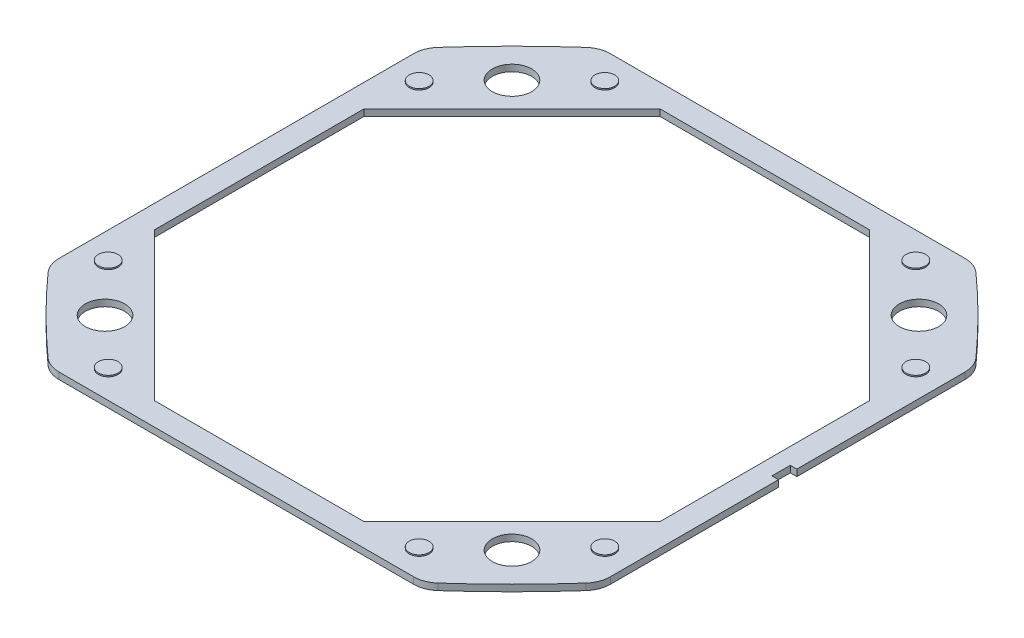
from build123d import *

# Parameters (mm, degrees)
ESBO_O1_R                = 1.5
RESSALTO_EXTRUS_O1_DEPTH = 0.25
RESSALTO_EXTRUS_O2_START = 0.25
ESBO_O1_3_R              = 0.75
RESSALTO_EXTRUS_O2_DEPTH = 0.1
CORTE_EXTRUS_O1_START    = -0.25
ESBO_O1_4_R              = 0.75
CORTE_EXTRUS_O1_DEPTH    = 0.1
FILETE1_R                = 2


with BuildPart() as part:
    # Esboço1 → Ressalto-extrusão1 (new, symmetric)
    with BuildSketch(Plane(origin=(0, 0, 0), x_dir=(1, 0, 0), z_dir=(0, 1, 0))):
        with BuildLine():
            Line((-14.269532703, -20.99999997), (14.269532672, -20.99999997))
            ThreePointArc((14.269532672, -20.99999997), (17.748380193, -17.748380193), (20.99999997, -14.269532672))
            Line((20.99999997, -14.269532672), (20.99999997, -0.699999985))
            Line((20.99999997, -0.699999985), (20.49999997, -0.699999985))
            Line((20.49999997, -0.699999985), (20.49999997, 0.700000015))
            Line((20.49999997, 0.700000015), (20.99999997, 0.700000015))
            Line((20.99999997, 0.700000015), (20.99999997, 14.269532702))
            ThreePointArc((20.99999997, 14.269532702), (17.748380193, 17.748380223), (14.269532672, 21))
            Line((14.269532672, 21), (-14.269532702, 21))
            ThreePointArc((-14.269532702, 21), (-17.748380223, 17.748380223), (-21, 14.269532703))
            Line((-21, 14.269532703), (-21, -14.269532672))
            ThreePointArc((-21, -14.269532672), (-17.748380223, -17.748380193), (-14.269532703, -20.99999997))
        make_face()
        with Locations(Location((15.5, 15.5, 0), (0, 0, 270))):
            Circle(ESBO_O1_R, mode=Mode.SUBTRACT)
        with Locations(Location((-15.5, 15.5, 0), (0, 0, 270))):
            Circle(ESBO_O1_R, mode=Mode.SUBTRACT)
        with Locations(Location((-15.5, -15.5, 0), (0, 0, 270))):
            Circle(ESBO_O1_R, mode=Mode.SUBTRACT)
        with Locations(Location((15.5, -15.5, 0), (0, 0, 270))):
            Circle(ESBO_O1_R, mode=Mode.SUBTRACT)
        Polygon((19.25, 7.973611076), (7.973611076, 19.25), (-7.973611076, 19.25), (-19.25, 7.973611076), (-19.25, -7.973611076), (-7.973611076, -19.25), (7.973611076, -19.25), (19.25, -7.973611076), align=None, mode=Mode.SUBTRACT)
    extrude(amount=RESSALTO_EXTRUS_O1_DEPTH, both=True)

    # Esboço1<3> → Ressalto-extrusão2 (add)
    with BuildSketch(Plane(origin=(0, 0, 0), x_dir=(1, 0, 0), z_dir=(0, 1, 0)).offset(RESSALTO_EXTRUS_O2_START)):
        with Locations(Location((-18.915106397, 11.844038585, 0), (0, 0, 90))):
            Circle(ESBO_O1_3_R)
        with Locations(Location((-11.844038585, 18.915106397, 0), (0, 0, 90))):
            Circle(ESBO_O1_3_R)
        with Locations(Location((11.844038585, 18.915106397, 0), (0, 0, 90))):
            Circle(ESBO_O1_3_R)
        with Locations(Location((18.915106397, 11.844038585, 0), (0, 0, 90))):
            Circle(ESBO_O1_3_R)
        with Locations(Location((18.915106397, -11.844038585, 0), (0, 0, 90))):
            Circle(ESBO_O1_3_R)
        with Locations(Location((11.844038585, -18.915106397, 0), (0, 0, 90))):
            Circle(ESBO_O1_3_R)
        with Locations(Location((-11.844038585, -18.915106397, 0), (0, 0, 90))):
            Circle(ESBO_O1_3_R)
        with Locations(Location((-18.915106397, -11.844038585, 0), (0, 0, 90))):
            Circle(ESBO_O1_3_R)
    extrude(amount=RESSALTO_EXTRUS_O2_DEPTH)

    # Esboço1<4> → Corte-extrusão1 (cut)
    with BuildSketch(Plane(origin=(0, 0, 0), x_dir=(1, 0, 0), z_dir=(0, 1, 0)).offset(CORTE_EXTRUS_O1_START)):
        with Locations(Location((-11.844038585, -18.915106397, 0), (0, 0, 90))):
            Circle(ESBO_O1_4_R)
        with Locations(Location((18.915106397, -11.844038585, 0), (0, 0, 90))):
            Circle(ESBO_O1_4_R)
        with Locations(Location((-18.915106397, 11.844038585, 0), (0, 0, 90))):
            Circle(ESBO_O1_4_R)
        with Locations(Location((-18.915106397, -11.844038585, 0), (0, 0, 90))):
            Circle(ESBO_O1_4_R)
        with Locations(Location((11.844038585, -18.915106397, 0), (0, 0, 90))):
            Circle(ESBO_O1_4_R)
        with Locations(Location((18.915106397, 11.844038585, 0), (0, 0, 90))):
            Circle(ESBO_O1_4_R)
        with Locations(Location((11.844038585, 18.915106397, 0), (0, 0, 90))):
            Circle(ESBO_O1_4_R)
        with Locations(Location((-11.844038585, 18.915106397, 0), (0, 0, 90))):
            Circle(ESBO_O1_4_R)
    extrude(amount=CORTE_EXTRUS_O1_DEPTH, mode=Mode.SUBTRACT)

    # Filete1
    filete1_edges = [part.edges().sort_by_distance(p)[0] for p in [
        (-14.269532703, 0, 20.99999997),
        (14.269532672, 0, 20.99999997),
        (20.99999997, 0, 14.269532672),
        (20.99999997, 0, -14.269532702),
        (14.269532672, 0, -21),
        (-14.269532702, 0, -21),
        (-21, 0, -14.269532703),
        (-21, 0, 14.269532672),
    ]]
    fillet(filete1_edges, radius=FILETE1_R)


solid = part.part
